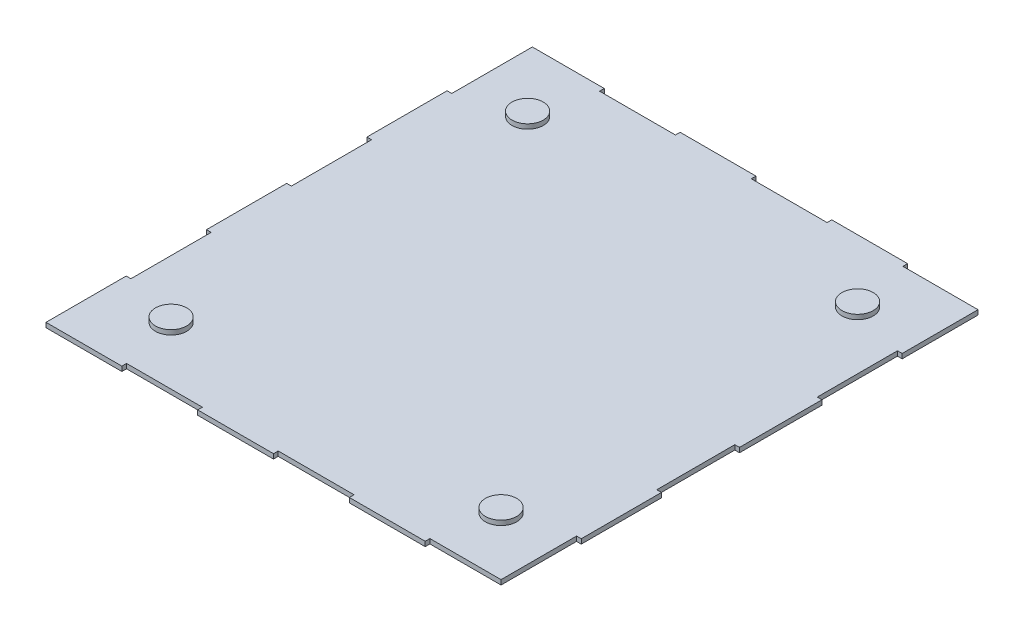
from build123d import *

# Parameters (mm, degrees)
EXTRUDE_1_DEPTH = 3
SKETCH_2_R      = 10
EXTRUDE_3_DEPTH = 6


with BuildPart() as part:
    # Эскиз1 → Бобышка-Вытянуть1 (new body)
    with BuildSketch(Plane(origin=(0, 0, 0), x_dir=(1, 0, 0), z_dir=(0, 1, 0))):
        Polygon((-130.811243507, 121.669438521), (-84.811243507, 121.669438521), (-84.811243507, 118.669438521), (-36.311243507, 118.669438521), (-36.311243507, 121.669438521), (12.188756493, 121.669438521), (12.188756493, 118.669438521), (60.688756493, 118.669438521), (60.688756493, 121.669438521), (109.188756493, 121.669438521), (109.188756493, 118.669438521), (157.188756493, 118.669438521), (157.188756493, 70.169438521), (154.188756493, 70.169438521), (154.188756493, 18.869438521), (157.188756493, 18.869438521), (157.188756493, -33.830561479), (154.188756493, -33.830561479), (154.188756493, -83.730561479), (157.188756493, -83.730561479), (157.188756493, -135.030561479), (154.188756493, -135.030561479), (154.188756493, -183.330561479), (108.688756493, -183.330561479), (108.688756493, -186.330561479), (60.188756493, -186.330561479), (60.188756493, -183.330561479), (11.688756493, -183.330561479), (11.688756493, -186.330561479), (-36.811243507, -186.330561479), (-36.811243507, -183.330561479), (-85.311243507, -183.330561479), (-85.311243507, -186.330561479), (-133.811243507, -186.330561479), (-133.811243507, -135.030561479), (-130.811243507, -135.030561479), (-130.811243507, -83.730561479), (-133.811243507, -83.730561479), (-133.811243507, -32.430561479), (-130.811243507, -32.430561479), (-130.811243507, 18.869438521), (-133.811243507, 18.869438521), (-133.811243507, 70.169438521), (-130.811243507, 70.169438521), align=None)
    extrude(amount=EXTRUDE_1_DEPTH)

    # Эскиз2 → Бобышка-Вытянуть3 (add)
    with BuildSketch(Plane.XZ):
        with Locations(Location((-93.811243507, 146.330561479, 0), (0, 0, 270))):
            Circle(SKETCH_2_R)
        with Locations(Location((117.188756493, 146.330561479, 0), (0, 0, 270))):
            Circle(SKETCH_2_R)
        with Locations(Location((117.188756493, -81.669438521, 0), (0, 0, 270))):
            Circle(SKETCH_2_R)
        with Locations(Location((-93.811243507, -81.669438521, 0), (0, 0, 270))):
            Circle(SKETCH_2_R)
    extrude(amount=-EXTRUDE_3_DEPTH)


solid = part.part
